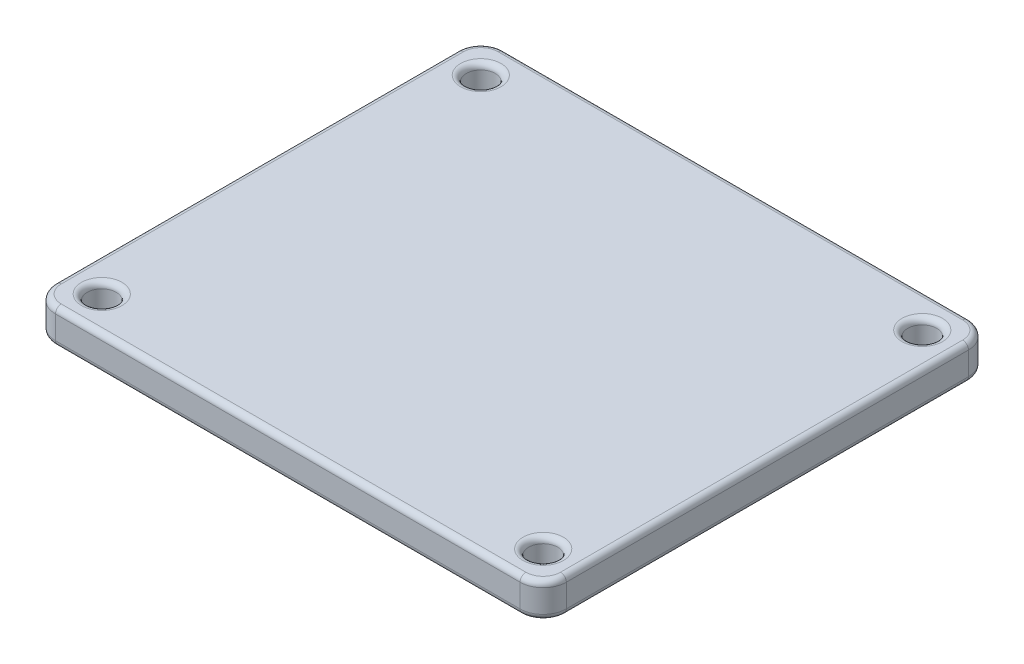
from build123d import *

# Parameters (mm, degrees)
SKETCH2_R           = 1.25
BOSS_EXTRUDE2_DEPTH = 3
FILLET3_R           = 0.5


with BuildPart() as part:
    # Sketch2 → Boss-Extrude2 (new body)
    with BuildSketch(Plane(origin=(0, 0, 0), x_dir=(1, 0, 0), z_dir=(0, 1, 0))):
        with BuildLine():
            Line((-20.1, 19.4), (20.1, 19.4))
            ThreePointArc((20.1, 19.4), (21.514213562, 18.814213562), (22.1, 17.4))
            Line((22.1, 17.4), (22.1, -17.4))
            ThreePointArc((22.1, -17.4), (21.514213562, -18.814213562), (20.1, -19.4))
            Line((20.1, -19.4), (-20.1, -19.4))
            ThreePointArc((-20.1, -19.4), (-21.514213562, -18.814213562), (-22.1, -17.4))
            Line((-22.1, -17.4), (-22.1, 17.4))
            ThreePointArc((-22.1, 17.4), (-21.514213562, 18.814213562), (-20.1, 19.4))
        make_face()
        with Locations(Location((-19.1, 16.4, 0), (0, 0, 270))):
            Circle(SKETCH2_R, mode=Mode.SUBTRACT)
        with Locations(Location((19.1, 16.4, 0), (0, 0, 90))):
            Circle(SKETCH2_R, mode=Mode.SUBTRACT)
        with Locations(Location((19.1, -16.4, 0), (0, 0, 270))):
            Circle(SKETCH2_R, mode=Mode.SUBTRACT)
        with Locations(Location((-19.1, -16.4, 0), (0, 0, 90))):
            Circle(SKETCH2_R, mode=Mode.SUBTRACT)
    extrude(amount=BOSS_EXTRUDE2_DEPTH)

    # Fillet3
    fillet3_edges = [part.edges().sort_by_distance(p)[0] for p in [
        (-22.1, 0, 0),
        (-21.514213562, 0, -18.814213562),
        (0, 0, -19.4),
        (21.514213562, 0, -18.814213562),
        (-21.514213562, 3, -18.814213562),
        (-22.1, 3, 0),
        (-21.514213562, 3, 18.814213562),
        (-19.1, 0, -17.65),
        (-19.1, 3, -17.65),
        (0, 3, 19.4),
        (19.1, 0, -15.15),
        (19.1, 3, -15.15),
        (21.514213562, 3, 18.814213562),
        (19.1, 0, 15.15),
        (19.1, 3, 15.15),
        (22.1, 3, 0),
        (-19.1, 0, 17.65),
        (-19.1, 3, 17.65),
        (21.514213562, 3, -18.814213562),
        (22.1, 0, 0),
        (0, 3, -19.4),
        (21.514213562, 0, 18.814213562),
        (0, 0, 19.4),
        (-21.514213562, 0, 18.814213562),
    ]]
    fillet(fillet3_edges, radius=FILLET3_R)


solid = part.part
